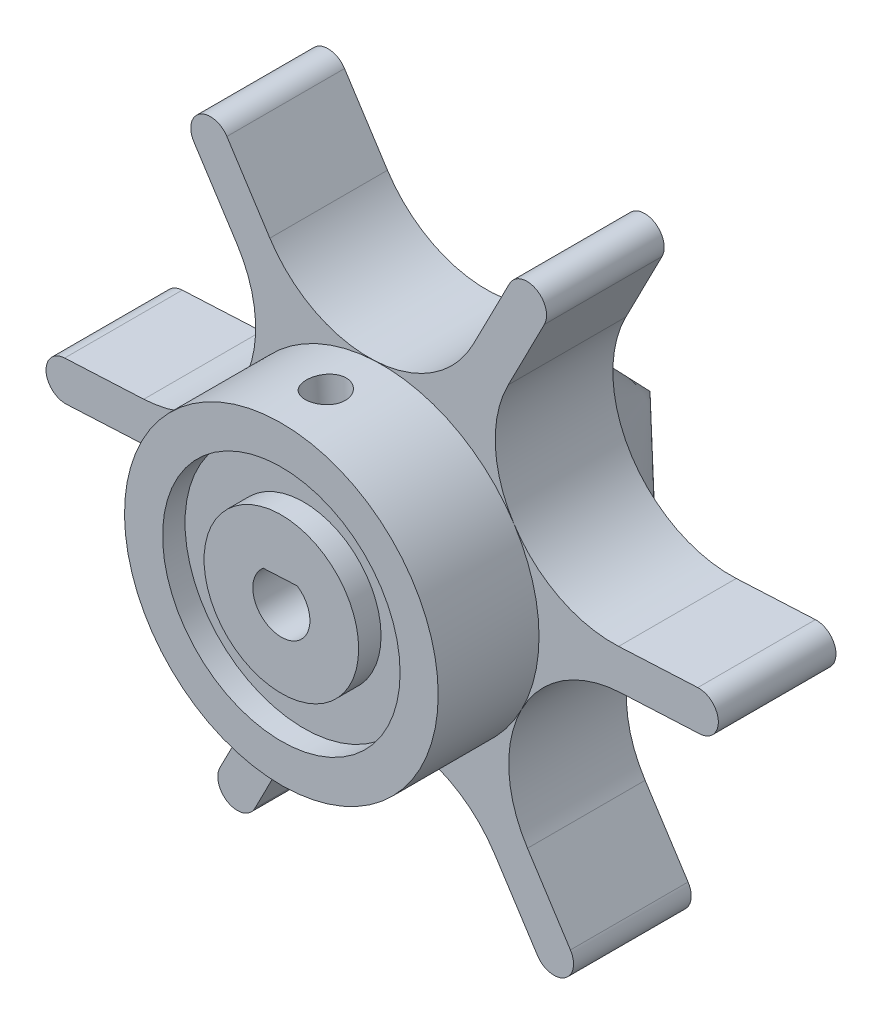
from build123d import *

# Parameters (mm, degrees)
SKETCH1_R               = 3.5
BOSS_EXTRUDE1_DEPTH     = 21
SKETCH4_R               = 28
BOSS_EXTRUDE2_DEPTH     = 18
SKETCH6_R               = 21.2
SKETCH6_R_2             = 13.8
CUT_EXTRUDE1_DEPTH      = 4
CUT_EXTRUDE2_DEPTH      = 20
CUT_EXTRUDE3_DEPTH      = 93.206949894
CUT_EXTRUDE3_DEPTH_BACK = 93.206949894
SKETCH7_R               = 1.75
SKETCH8_R               = 3.5
CUT_EXTRUDE4_DEPTH      = 5.5


with BuildPart() as part:
    # Sketch1 → Boss-Extrude1 (new body)
    with BuildSketch(Plane.XY):
        with BuildLine():
            ThreePointArc((-27.16441994, 47.550254291), (-29.67571676, 44.192804958), (-33.605829095, 45.653385243))
            Line((-33.605829095, 45.653385243), (-25.93972411, 33.765821671))
            ThreePointArc((-25.93972411, 33.765821671), (-24.90753088, 12.791204222), (-42.555985811, 1.409989939))
            Line((-42.555985811, 1.409989939), (-56.683970347, 0.71473006))
            ThreePointArc((-56.683970347, 0.71473006), (-54.098653318, -0.246072778), (-53.011938142, -2.781039515))
            ThreePointArc((-53.011938142, -2.781039515), (-53.976971405, -5.194324339), (-56.339905937, -6.27680909))
            Line((-56.339905937, -6.27680909), (-42.211921401, -5.581549211))
            ThreePointArc((-42.211921401, -5.581549211), (-23.531273241, -15.174952377), (-22.499080012, -36.149569826))
            Line((-22.499080012, -36.149569826), (-28.960959562, -48.732393278))
            ThreePointArc((-28.960959562, -48.732393278), (-25.025035607, -46.929305801), (-22.347518202, -50.331293805))
            ThreePointArc((-22.347518202, -50.331293805), (-22.445530198, -51.153776401), (-22.734076842, -51.930194333))
            Line((-22.734076842, -51.930194333), (-16.272197292, -39.347370882))
            ThreePointArc((-16.272197292, -39.347370882), (1.376257639, -27.966156599), (20.0569058, -37.559559765))
            Line((20.0569058, -37.559559765), (27.723010785, -49.447123338))
            ThreePointArc((27.723010785, -49.447123338), (28.767550893, -44.608845135), (33.605829095, -45.653385243))
            Line((33.605829095, -45.653385243), (25.93972411, -33.765821671))
            ThreePointArc((25.93972411, -33.765821671), (24.90753088, -12.791204222), (42.555985811, -1.409989939))
            Line((42.555985811, -1.409989939), (56.683970347, -0.71473006))
            ThreePointArc((56.683970347, -0.71473006), (53.016168567, 2.60900731), (56.339905937, 6.27680909))
            Line((56.339905937, 6.27680909), (42.211921401, 5.581549211))
            ThreePointArc((42.211921401, 5.581549211), (23.531273241, 15.174952377), (22.499080012, 36.149569826))
            Line((22.499080012, 36.149569826), (28.960959562, 48.732393278))
            ThreePointArc((28.960959562, 48.732393278), (24.248617674, 47.217852445), (22.734076842, 51.930194333))
            Line((22.734076842, 51.930194333), (16.272197292, 39.347370882))
            ThreePointArc((16.272197292, 39.347370882), (-1.376257639, 27.966156599), (-20.0569058, 37.559559765))
            Line((-20.0569058, 37.559559765), (-27.723010785, 49.447123338))
            ThreePointArc((-27.723010785, 49.447123338), (-27.306970607, 48.538957471), (-27.16441994, 47.550254291))
        make_face()
        with Locations((-56.511938142, -2.781039515)):
            Circle(SKETCH1_R)
        with Locations((-30.66441994, 47.550254291)):
            Circle(SKETCH1_R)
        with Locations((25.847518202, 50.331293805)):
            Circle(SKETCH1_R)
        with Locations((56.511938142, 2.781039515)):
            Circle(SKETCH1_R)
        with Locations((30.66441994, -47.550254291)):
            Circle(SKETCH1_R)
        with Locations((-25.847518202, -50.331293805)):
            Circle(SKETCH1_R)
    extrude(amount=BOSS_EXTRUDE1_DEPTH)

    # Sketch3 → Revolve1 (revolve)
    with BuildSketch(Plane(origin=(0, 0, 0), x_dir=(-0.9987913071010414, -0.04915205854685543, 0), z_dir=(0.04915205854685543, -0.9987913071010414, 0)), mode=Mode.PRIVATE) as revolve1_sk:
        Polygon((0, 0), (-28, 0), (0, 26.813467396), align=None)
    revolve(revolve1_sk.sketch.rotate(Axis((0, 0, -26.813467396), (0, 0, 1)), 357.182659299), axis=Axis((0, 0, -26.813467396), (0, 0, 1)))

    # Sketch4 → Boss-Extrude2 (add)
    with BuildSketch(Plane.XY.offset(21)):
        with Locations(Location((0, 0, 0), (0, 0, 152.817340701))):
            Circle(SKETCH4_R)
    extrude(amount=BOSS_EXTRUDE2_DEPTH)

    # Sketch6 → Cut-Extrude1 (cut)
    with BuildSketch(Plane.XY.offset(39)):
        Circle(SKETCH6_R)
        Circle(SKETCH6_R_2, mode=Mode.SUBTRACT)
    extrude(amount=-CUT_EXTRUDE1_DEPTH, mode=Mode.SUBTRACT)

    # Sketch5 → Cut-Extrude2 (cut)
    with BuildSketch(Plane.XY.offset(39)):
        with BuildLine():
            Line((2.82796059, 4.244129934), (-3.231007471, 3.945958784))
            ThreePointArc((-3.231007471, 3.945958784), (-2.183101223, -4.609128882), (5.1, 0))
            ThreePointArc((5.1, 0), (4.496253941, 2.407010697), (2.82796059, 4.244129934))
        make_face()
    extrude(amount=-CUT_EXTRUDE2_DEPTH, mode=Mode.SUBTRACT)

    # Sketch7 → Cut-Extrude3 (cut, two sides: drawn at the far end of the back side and taken through both)
    with BuildSketch(Plane(origin=(-0.20152344, 4.095044359, 0), x_dir=(0.9987913071010414, 0.049152058546853936, 0), z_dir=(0.049152058546853936, -0.9987913071010414, 0)).offset(-CUT_EXTRUDE3_DEPTH_BACK)):
        with Locations((0, 29.7)):
            Circle(SKETCH7_R)
    extrude(amount=CUT_EXTRUDE3_DEPTH + CUT_EXTRUDE3_DEPTH_BACK, mode=Mode.SUBTRACT)

    # Sketch8 → Cut-Extrude4 (cut)
    with BuildSketch(Plane(origin=(-1.376257639, 27.966156599, 0), x_dir=(0.9987913071010414, 0.049152058546855434, 0), z_dir=(-0.049152058546855434, 0.9987913071010414, 0))):
        with Locations(Location((0, -29.7, 0), (0, 0, 180))):
            Circle(SKETCH8_R)
    extrude(amount=-CUT_EXTRUDE4_DEPTH, mode=Mode.SUBTRACT)


solid = part.part
